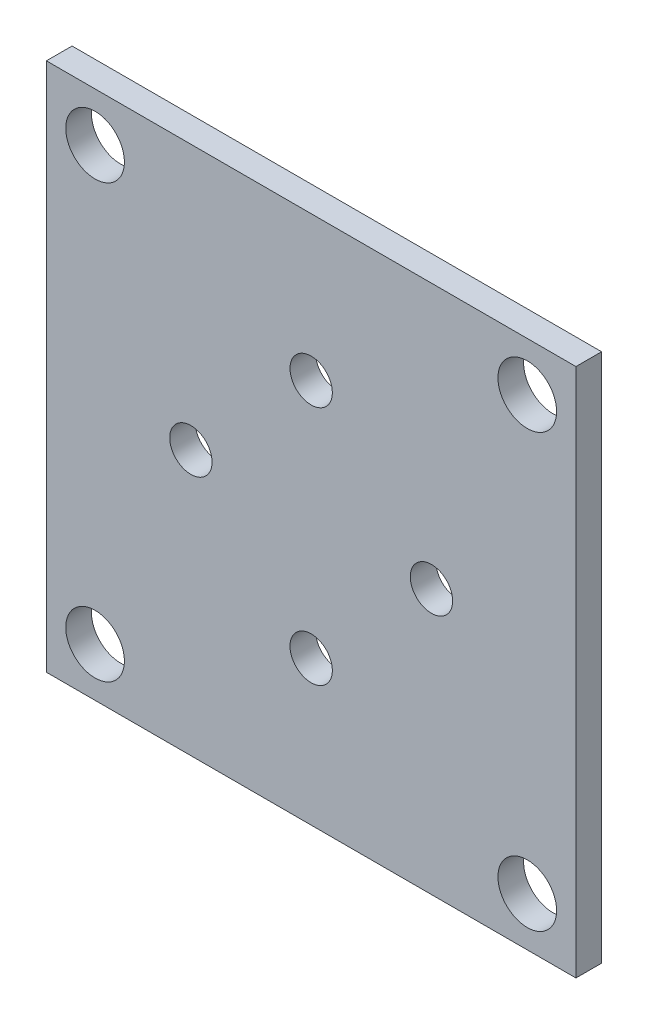
from build123d import *

# Parameters (mm, degrees)
SKETCH1_W                   = 33.02
SKETCH1_H                   = 33.02
BOSS_EXTRUDE1_DEPTH         = 1.6002
F_27_0_144_DIAMETER_HOLE1_D = 3.6576
F_37_0_104_DIAMETER_HOLE1_D = 2.6416


with BuildPart() as part:
    # Sketch1 → Boss-Extrude1 (new body)
    with BuildSketch(Plane.XY):
        Rectangle(SKETCH1_W, SKETCH1_H)
    extrude(amount=BOSS_EXTRUDE1_DEPTH)

    # #27 (0.144) Diameter Hole1 (through all)
    with Locations(Plane.XY.offset(1.6002)):
        with Locations((-13.4747, 13.4747), (13.4747, 13.4747), (13.4747, -13.4747), (-13.4747, -13.4747)):
            Hole(F_27_0_144_DIAMETER_HOLE1_D / 2)

    # #37 (0.104) Diameter Hole1 (through all)
    with Locations(Plane.XY.offset(1.6002)):
        with Locations((0, 7.5), (7.5, 0), (0, -7.5), (-7.5, 0)):
            Hole(F_37_0_104_DIAMETER_HOLE1_D / 2)


solid = part.part
